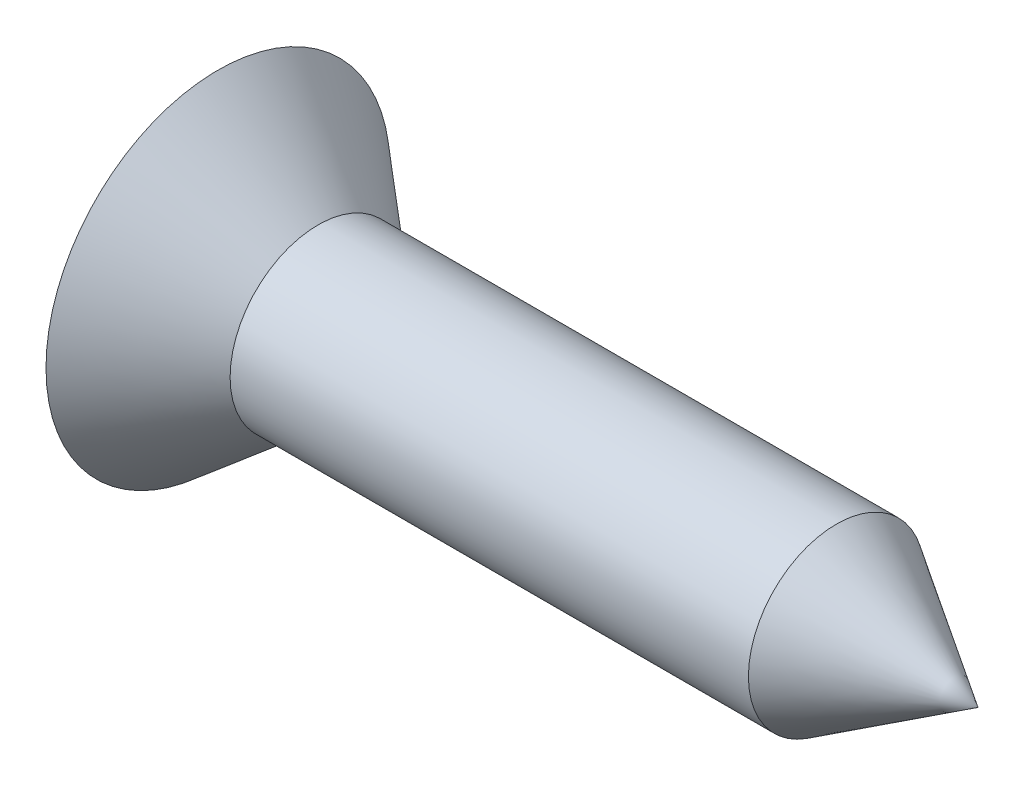
from build123d import *


with BuildPart() as part:
    # Skica1 → Rotovat1 (revolve)
    with BuildSketch(Plane.XY, mode=Mode.PRIVATE) as rotovat1_sk:
        Polygon((0, 0), (0, 2.15), (1.251341272, 1.1), (7.730035287, 1.1), (9.5, 0), align=None)
    revolve(rotovat1_sk.sketch.rotate(Axis((0, 0, 0), (1, 0, 0)), 90), axis=Axis((0, 0, 0), (1, 0, 0)))


solid = part.part
